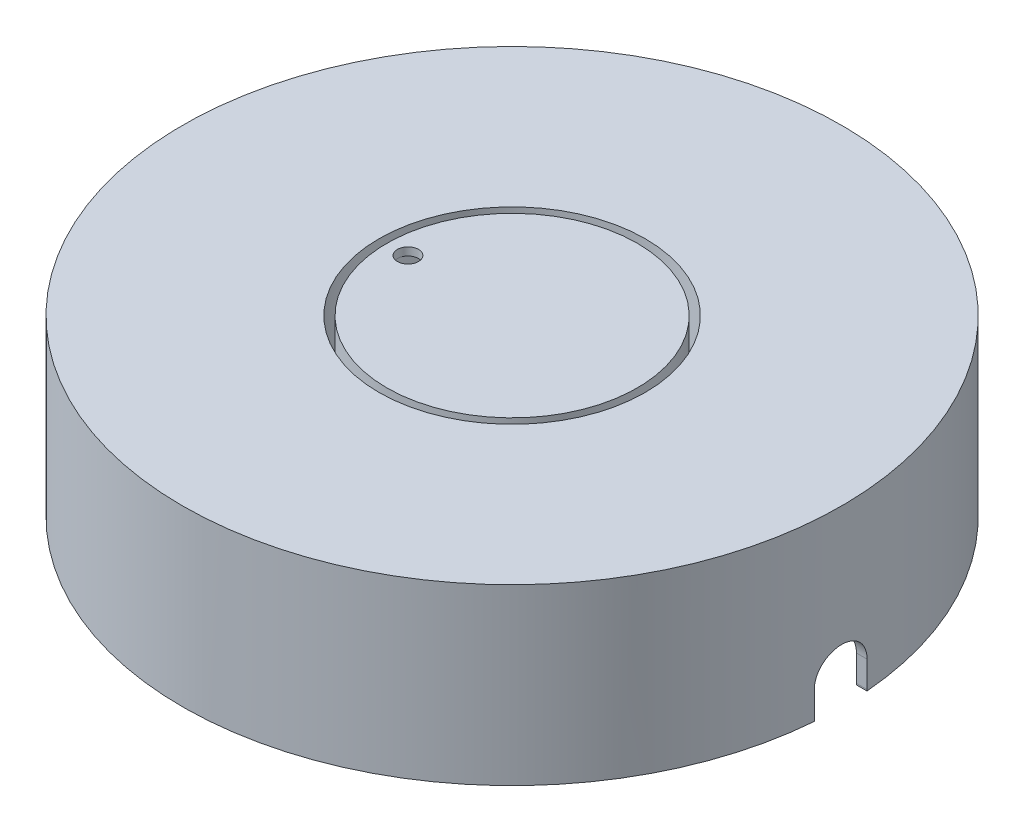
from build123d import *

# Parameters (mm, degrees)
SKETCH1_R             = 125
SKETCH1_R_2           = 50.5
BOSS_EXTRUDE1_DEPTH   = 3
SKETCH1_R_3           = 47.5
BOSS_EXTRUDE1_2_DEPTH = 3
BOSS_EXTRUDE2_START   = 50
SKETCH2_R             = 125
SKETCH2_R_2           = 121
SKETCH2_R_3           = 54.5
SKETCH2_R_4           = 50.5
SKETCH2_R_5           = 47.5
SKETCH2_R_6           = 43.5
BOSS_EXTRUDE2_DEPTH   = 50
BOSS_EXTRUDE3_START   = 3
SKETCH3_R             = 125
SKETCH3_R_2           = 121
SKETCH3_R_3           = 54.5
SKETCH3_R_4           = 43.5
BOSS_EXTRUDE3_DEPTH   = 3
BOSS_EXTRUDE4_START   = 10
SKETCH4_R             = 125
SKETCH4_R_2           = 121
BOSS_EXTRUDE4_DEPTH   = 10
SKETCH5_R             = 4
CUT_EXTRUDE1_DEPTH    = 10
CUT_EXTRUDE2_DEPTH    = 10


with BuildPart() as part:
    # Sketch1 → Boss-Extrude1 (new body)
    with BuildSketch(Plane(origin=(0, 0, 0), x_dir=(1, 0, 0), z_dir=(0, 1, 0))):
        with Locations(Location((0, 0, 0), (0, 0, 270))):
            Circle(SKETCH1_R)
        with Locations(Location((0, 0, 0), (0, 0, 270))):
            Circle(SKETCH1_R_2, mode=Mode.SUBTRACT)
    extrude(amount=BOSS_EXTRUDE1_DEPTH)



with BuildPart() as body_2:
    # Sketch1 → Boss-Extrude1 2 (new body)
    with BuildSketch(Plane(origin=(0, 0, 0), x_dir=(1, 0, 0), z_dir=(0, 1, 0))):
        with Locations(Location((0, 0, 0), (0, 0, 270))):
            Circle(SKETCH1_R_3)
    extrude(amount=BOSS_EXTRUDE1_2_DEPTH)


with BuildPart() as part_1:
    add(part.part)

    add(body_2.part)  # Boss-Extrude2 merges body 2
    # Sketch2 → Boss-Extrude2 (add)
    # profile 1 of 3: a face of its own
    with BuildSketch(Plane.XZ.offset(BOSS_EXTRUDE2_START)):
        with Locations(Location((0, 0, 0), (0, 0, 270))):
            Circle(SKETCH2_R)
        with Locations(Location((0, 0, 0), (0, 0, 270))):
            Circle(SKETCH2_R_2, mode=Mode.SUBTRACT)
    # profile 2 of 3: a face of its own
    with BuildSketch(Plane.XZ.offset(BOSS_EXTRUDE2_START)):
        with Locations(Location((0, 0, 0), (0, 0, 90))):
            Circle(SKETCH2_R_3)
        with Locations(Location((0, 0, 0), (0, 0, 270))):
            Circle(SKETCH2_R_4, mode=Mode.SUBTRACT)
    # profile 3 of 3: a face of its own
    with BuildSketch(Plane.XZ.offset(BOSS_EXTRUDE2_START)):
        with Locations(Location((0, 0, 0), (0, 0, 270))):
            Circle(SKETCH2_R_5)
        with Locations(Location((0, 0, 0), (0, 0, 270))):
            Circle(SKETCH2_R_6, mode=Mode.SUBTRACT)
    extrude(amount=-BOSS_EXTRUDE2_DEPTH)

    # Sketch3 → Boss-Extrude3 (add)
    # profile 1 of 2: a face of its own
    with BuildSketch(Plane.XZ.offset(50).offset(BOSS_EXTRUDE3_START)):
        with Locations(Location((0, 0, 0), (0, 0, 270))):
            Circle(SKETCH3_R)
        with Locations(Location((0, 0, 0), (0, 0, 270))):
            Circle(SKETCH3_R_2, mode=Mode.SUBTRACT)
    # profile 2 of 2: a face of its own
    with BuildSketch(Plane.XZ.offset(50).offset(BOSS_EXTRUDE3_START)):
        with Locations(Location((0, 0, 0), (0, 0, 90))):
            Circle(SKETCH3_R_3)
        with Locations(Location((0, 0, 0), (0, 0, 270))):
            Circle(SKETCH3_R_4, mode=Mode.SUBTRACT)
    extrude(amount=-BOSS_EXTRUDE3_DEPTH)

    # Sketch4 → Boss-Extrude4 (add)
    with BuildSketch(Plane.XZ.offset(53).offset(BOSS_EXTRUDE4_START)):
        with Locations(Location((0, 0, 0), (0, 0, 270))):
            Circle(SKETCH4_R)
        with Locations(Location((0, 0, 0), (0, 0, 270))):
            Circle(SKETCH4_R_2, mode=Mode.SUBTRACT)
    extrude(amount=-BOSS_EXTRUDE4_DEPTH)

    # Sketch5 → Cut-Extrude1 (cut)
    with BuildSketch(Plane.XZ):
        with Locations(Location((-39.5, 0, 0), (0, 0, 180))):
            Circle(SKETCH5_R)
    extrude(amount=-CUT_EXTRUDE1_DEPTH, mode=Mode.SUBTRACT)

    # Sketch6 → Cut-Extrude2 (cut)
    with BuildSketch(Plane(origin=(125, 0, 0), x_dir=(0, 0, -1), z_dir=(1, 0, 0))):
        with BuildLine():
            Line((-10, -62.519064438), (-10, -52.519064438))
            ThreePointArc((-10, -52.519064438), (0, -42.519064438), (10, -52.519064438))
            Line((10, -52.519064438), (10, -62.519064438))
            ThreePointArc((10, -62.519064438), (0, -72.519064438), (-10, -62.519064438))
        make_face()
    extrude(amount=-CUT_EXTRUDE2_DEPTH, mode=Mode.SUBTRACT)


solid = part_1.part
